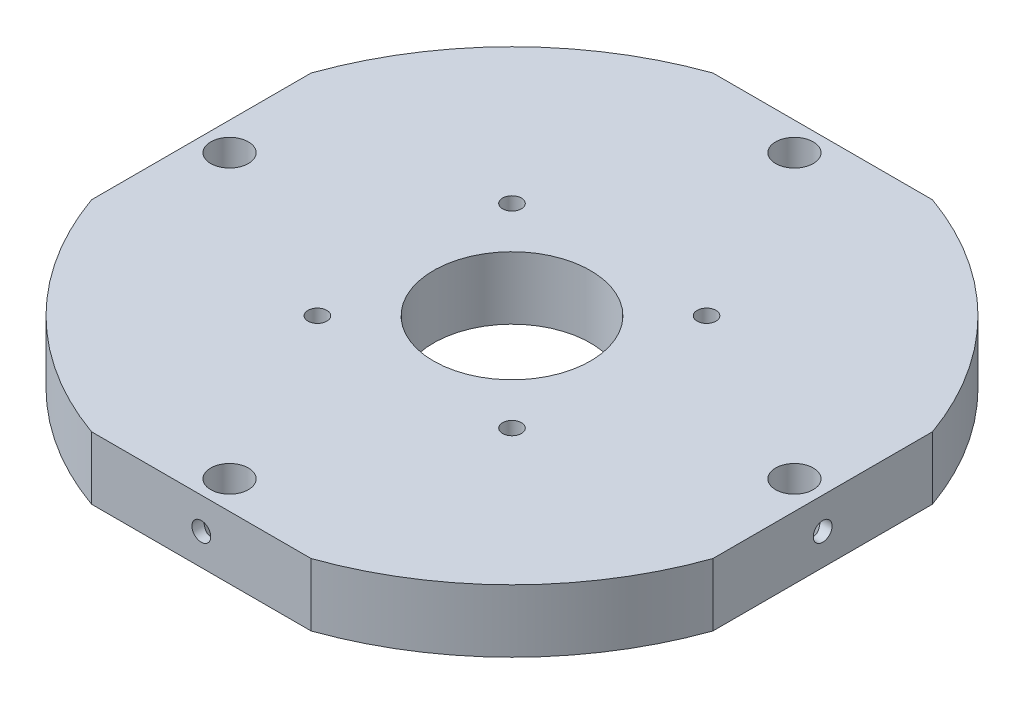
from build123d import *

# Parameters (mm, degrees)
SKETCH1_R               = 52.5
BOSS_EXTRUDE1_DEPTH     = 10
SKETCH3_R               = 3
CUT_EXTRUDE1_DEPTH      = 75.916620319
SKETCH4_W               = 34.98571137
SKETCH4_H               = 10
SKETCH4_W_2             = 10
SKETCH4_H_2             = 34.98571137
CUT_EXTRUDE_THIN1_DEPTH = 75.916620319
CUT_EXTRUDE3_REACH      = 113.136
CUT_EXTRUDE3_END_RADIUS = 3
SKETCH5_R               = 1.5
CIRPATTERN1_COUNT       = 4
SKETCH6_R               = 12.5
CUT_EXTRUDE4_DEPTH      = 71.714213718
SKETCH7_R               = 1.5
CUT_EXTRUDE5_DEPTH      = 71.714213718


with BuildPart() as part:
    # Sketch1 → Boss-Extrude1 (new body)
    with BuildSketch(Plane(origin=(0, 0, 0), x_dir=(1, 0, 0), z_dir=(0, 1, 0))):
        with Locations(Location((0, 0, 0), (0, 0, 270))):
            Circle(SKETCH1_R)
    extrude(amount=BOSS_EXTRUDE1_DEPTH)

    # Sketch3 → Cut-Extrude1 (cut, through all)
    with BuildSketch(Plane(origin=(0, 10, 0), x_dir=(1, 0, 0), z_dir=(0, 1, 0))):
        with Locations(Location((0, 45, 0), (0, 0, 270))):
            Circle(SKETCH3_R)
        with Locations(Location((45, 0, 0), (0, 0, 270))):
            Circle(SKETCH3_R)
        with Locations(Location((0, -45, 0), (0, 0, 270))):
            Circle(SKETCH3_R)
        with Locations(Location((-45, 0, 0), (0, 0, 270))):
            Circle(SKETCH3_R)
    extrude(amount=-CUT_EXTRUDE1_DEPTH, mode=Mode.SUBTRACT)

    # Sketch4 → Cut-Extrude-Thin1 (cut, through all)
    with BuildSketch(Plane(origin=(0, 10, 0), x_dir=(1, 0, 0), z_dir=(0, 1, 0))):
        with Locations((0, -54.5)):
            Rectangle(SKETCH4_W, SKETCH4_H)
        with Locations((54.5, 0)):
            Rectangle(SKETCH4_W_2, SKETCH4_H_2)
        with Locations((0, 54.5)):
            Rectangle(SKETCH4_W, SKETCH4_H)
        with Locations((-54.5, 0)):
            Rectangle(SKETCH4_W_2, SKETCH4_H_2)
    extrude(amount=-CUT_EXTRUDE_THIN1_DEPTH, mode=Mode.SUBTRACT)

    # Cut-Extrude3: up to this cylinder (the profile starts outside it)
    cut_extrude3_end = Plane(origin=(0, 5, 45), z_dir=(0, 1, 0)) * Cylinder(CUT_EXTRUDE3_END_RADIUS, 233.272, mode=Mode.PRIVATE)
    # Sketch5 → Cut-Extrude3 (cut, up to the surface)
    with BuildSketch(Plane.XY.offset(49.5), mode=Mode.PRIVATE) as cut_extrude3_sk1:
        with Locations((0, 5)):
            Circle(SKETCH5_R)
    cut_extrude3_tool1 = extrude(cut_extrude3_sk1.sketch, amount=-CUT_EXTRUDE3_REACH, mode=Mode.PRIVATE) - cut_extrude3_end
    cut_extrude3 = cut_extrude3_tool1.solids().sort_by_distance((0, 5, 49.5))[0]
    add(cut_extrude3, mode=Mode.SUBTRACT)

    # CirPattern1: Cut-Extrude3 ×4 about axis
    cirpattern1_axis = Axis((0, 10, 0), (0, -1, 0))
    for i in range(1, CIRPATTERN1_COUNT):
        add(cut_extrude3.rotate(cirpattern1_axis, i * 360 / CIRPATTERN1_COUNT), mode=Mode.SUBTRACT)

    # Sketch6 → Cut-Extrude4 (cut, through all)
    with BuildSketch(Plane(origin=(0, 10, 0), x_dir=(1, 0, 0), z_dir=(0, 1, 0))):
        with Locations(Location((0, 0, 0), (0, 0, 270))):
            Circle(SKETCH6_R)
    extrude(amount=-CUT_EXTRUDE4_DEPTH, mode=Mode.SUBTRACT)

    # Sketch7 → Cut-Extrude5 (cut, through all)
    with BuildSketch(Plane(origin=(0, 10, 0), x_dir=(1, 0, 0), z_dir=(0, 1, 0))):
        with Locations(Location((-15.5, 15.5, 0), (0, 0, 270))):
            Circle(SKETCH7_R)
        with Locations(Location((15.5, 15.5, 0), (0, 0, 90))):
            Circle(SKETCH7_R)
        with Locations(Location((15.5, -15.5, 0), (0, 0, 270))):
            Circle(SKETCH7_R)
        with Locations(Location((-15.5, -15.5, 0), (0, 0, 90))):
            Circle(SKETCH7_R)
    extrude(amount=-CUT_EXTRUDE5_DEPTH, mode=Mode.SUBTRACT)


solid = part.part
